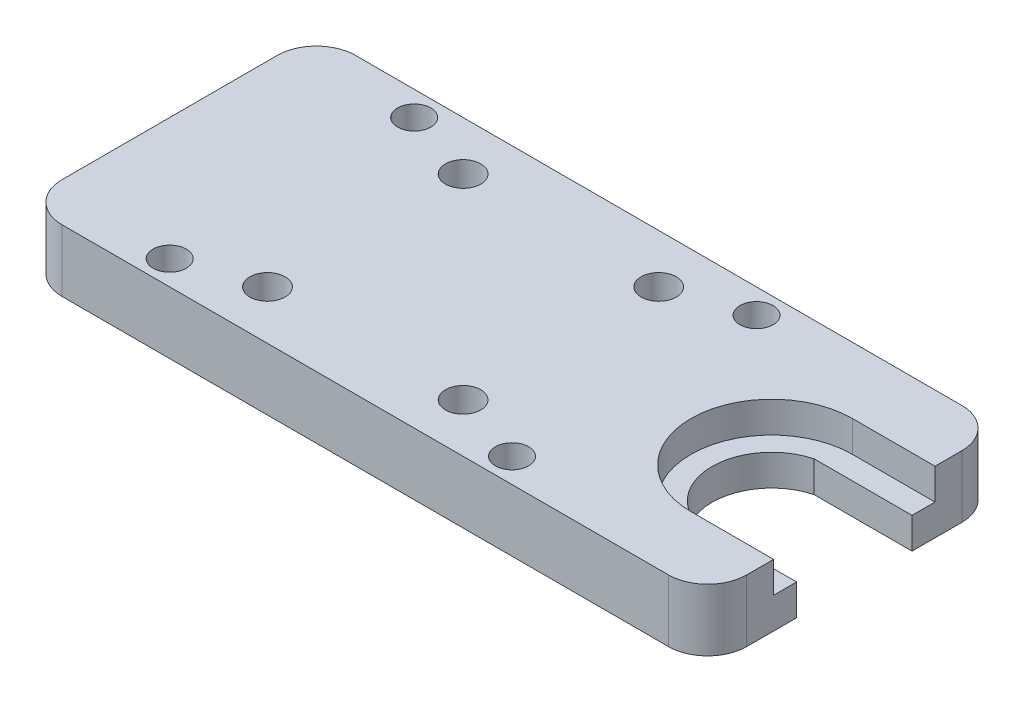
from build123d import *

# Parameters (mm, degrees)
SKETCH1_W            = 70
SKETCH1_H            = 30
BOSS_EXTRUDE1_DEPTH  = 6.35
CUT_EXTRUDE1_DEPTH   = 54.400117041
CUT_EXTRUDE2_DEPTH   = 3.175
M3_CLEARANCE_HOLE2_D = 3.6
FILLET1_R            = 4
M3_CLEARANCE_HOLE3_D = 3.4


with BuildPart() as part:
    # Sketch1 → Boss-Extrude1 (new body)
    with BuildSketch(Plane.XZ):
        with Locations((-6.5, 18)):
            Rectangle(SKETCH1_W, SKETCH1_H)
    extrude(amount=-BOSS_EXTRUDE1_DEPTH)

    # Sketch9 → Cut-Extrude1 (cut, through all)
    with BuildSketch(Plane(origin=(0, 6.35, 0), x_dir=(1, 0, 0), z_dir=(0, 1, 0))):
        with BuildLine():
            Line((28.5, -12.1), (18.5, -12.1))
            ThreePointArc((18.5, -12.1), (13.949193338, -18), (18.5, -23.9))
            Line((18.5, -23.9), (28.5, -23.9))
            Line((28.5, -23.9), (28.5, -12.1))
        make_face()
    extrude(amount=-CUT_EXTRUDE1_DEPTH, mode=Mode.SUBTRACT)

    # Sketch10 → Cut-Extrude2 (cut)
    with BuildSketch(Plane(origin=(0, 6.35, 0), x_dir=(1, 0, 0), z_dir=(0, 1, 0))):
        with BuildLine():
            Line((28.5, -26.25), (20.049193338, -26.25))
            ThreePointArc((20.049193338, -26.25), (11.799193338, -18), (20.049193338, -9.75))
            Line((20.049193338, -9.75), (28.5, -9.75))
            Line((28.5, -9.75), (28.5, -26.25))
        make_face()
    extrude(amount=-CUT_EXTRUDE2_DEPTH, mode=Mode.SUBTRACT)

    # M3 Clearance Hole2 (through all)
    with Locations(Plane(origin=(-21.5, 6.35, 28), x_dir=(0, 0, 1), z_dir=(0, 1, 0))):
        with Locations((0, 0), (-20, 0), (-20, 20), (0, 20)):
            Hole(M3_CLEARANCE_HOLE2_D / 2)

    # Fillet1
    fillet1_edges = [part.edges().sort_by_distance(p)[0] for p in [
        (-41.5, 3.175, 33),
        (28.5, 3.175, 33),
        (28.5, 3.175, 3),
        (-41.5, 3.175, 3),
    ]]
    fillet(fillet1_edges, radius=FILLET1_R)

    # M3 Clearance Hole3 (through all)
    with Locations(Plane(origin=(-29, 6.35, 5.5), x_dir=(0, 0, 1), z_dir=(0, 1, 0))):
        with Locations((0, 0), (25, 0), (25, 35), (0, 35)):
            Hole(M3_CLEARANCE_HOLE3_D / 2)


solid = part.part
